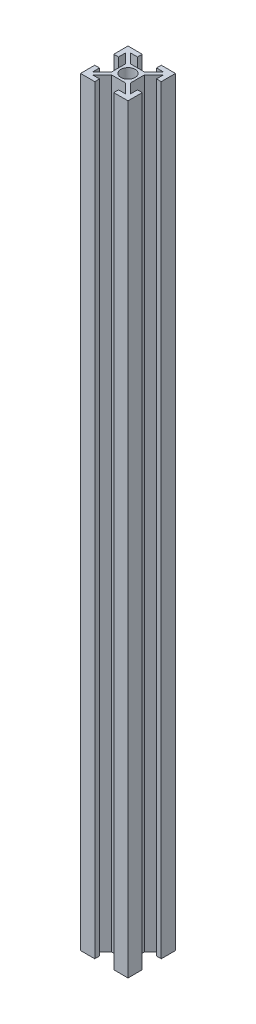
from build123d import *

# Parameters (mm, degrees)
F_2020_SKETCH_R     = 3
BOSS_EXTRUDE1_DEPTH = 320


with BuildPart() as part:
    # 2020 sketch → Boss-Extrude1 (new body)
    with BuildSketch(Plane(origin=(0, 0, 0), x_dir=(1, 0, 0), z_dir=(0, 1, 0))):
        Polygon((-4, 10), (-4, 8), (-7, 8), (-3, 4), (3, 4), (7, 8), (4, 8), (4, 10), (10, 10), (10, 4), (8, 4), (8, 7), (4, 3), (4, -3), (8, -7), (8, -4), (10, -4), (10, -10), (4, -10), (4, -8), (7, -8), (3, -4), (-3, -4), (-7, -8), (-4, -8), (-4, -10), (-10, -10), (-10, -4), (-8, -4), (-8, -7), (-4, -3), (-4, 3), (-8, 7), (-8, 4), (-10, 4), (-10, 10), align=None)
        with Locations(Location((0, 0, 0), (0, 0, 270))):
            Circle(F_2020_SKETCH_R, mode=Mode.SUBTRACT)
    extrude(amount=BOSS_EXTRUDE1_DEPTH)


solid = part.part
